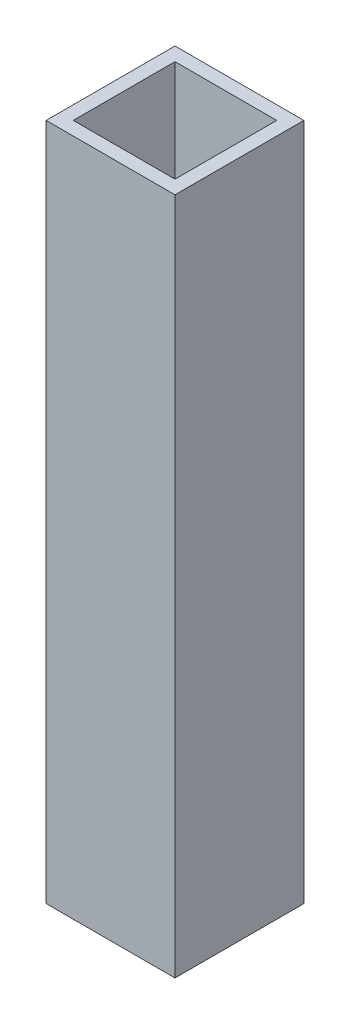
from build123d import *

# Parameters (mm, degrees)
SKETCH1_W           = 19
SKETCH1_H           = 19
SKETCH1_W_2         = 15
SKETCH1_H_2         = 15
EXTRUDE_THIN1_DEPTH = 100


with BuildPart() as part:
    # Sketch1 → Extrude-Thin1 (new body)
    with BuildSketch(Plane(origin=(0, 0, 0), x_dir=(1, 0, 0), z_dir=(0, 1, 0))):
        Rectangle(SKETCH1_W, SKETCH1_H)
        Rectangle(SKETCH1_W_2, SKETCH1_H_2, mode=Mode.SUBTRACT)
    extrude(amount=EXTRUDE_THIN1_DEPTH)


solid = part.part
